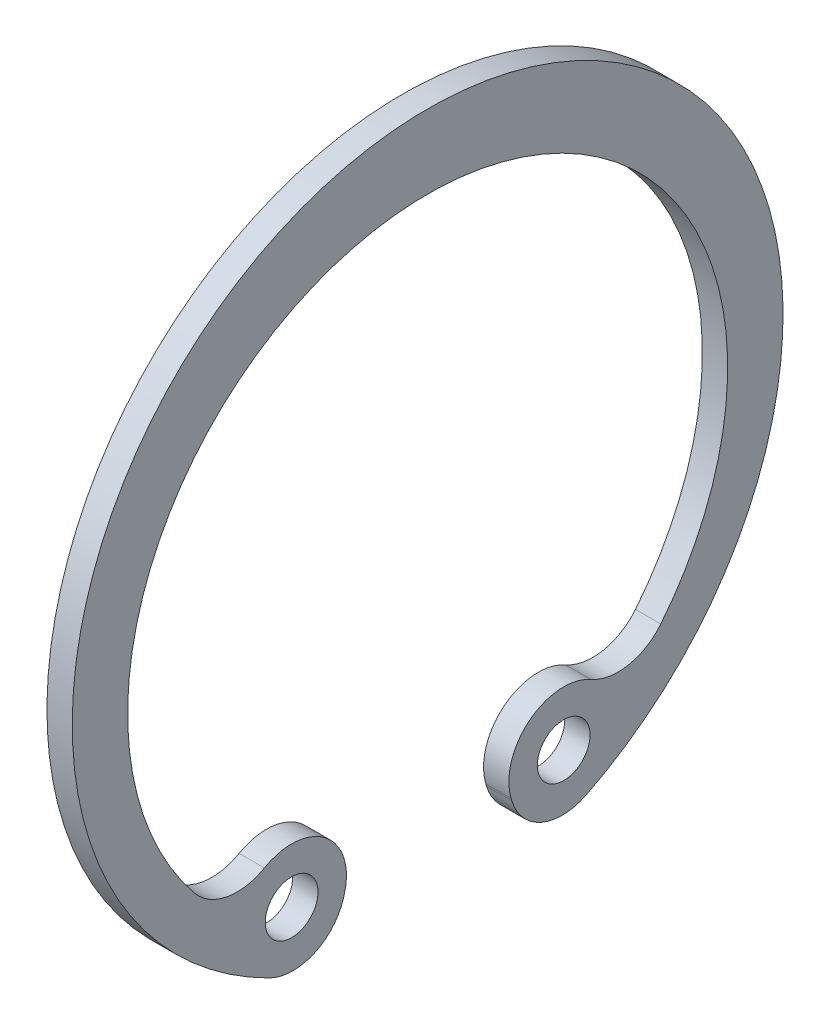
from build123d import *

# Parameters (mm, degrees)
BOSS_EXTRUDE1_DEPTH      = 0.6
BOSS_EXTRUDE1_DEPTH_BACK = 0.6
SKETCH1_R                = 1.25


with BuildPart() as part:
    # Sketch1 → Boss-Extrude1 (new, two sides: drawn at the far end of the back side and taken through both)
    with BuildSketch(Plane(origin=(0, 0, 0), x_dir=(0, 0, -1), z_dir=(1, 0, 0)).offset(-BOSS_EXTRUDE1_DEPTH_BACK)):
        with BuildLine():
            Line((-3.989591726, -13.555650403), (-3.955781017, -13.440769939))
            ThreePointArc((-3.955781017, -13.440769939), (-4.838154074, -10.666604704), (-7.741194161, -10.449963955))
            ThreePointArc((-7.741194161, -10.449963955), (-9.510855368, -10.748832352), (-11.052535247, -9.830003608))
            ThreePointArc((-11.052535247, -9.830003608), (-1.19e-07, 13.35), (11.052535397, -9.830003423))
            ThreePointArc((11.052535397, -9.830003423), (9.510855453, -10.748832336), (7.741194103, -10.449963921))
            ThreePointArc((7.741194103, -10.449963921), (4.838154048, -10.666604724), (3.955781017, -13.440769939))
            Line((3.955781017, -13.440769939), (3.989591726, -13.555650403))
            ThreePointArc((3.989591726, -13.555650403), (5.387658916, -15.140997106), (7.500750152, -15.088447473))
            ThreePointArc((7.500750152, -15.088447473), (0, 16.85), (-7.500750152, -15.088447473))
            ThreePointArc((-7.500750152, -15.088447473), (-5.387658916, -15.140997106), (-3.989591726, -13.555650403))
        make_face()
        with Locations((6.45, -12.706691151)):
            Circle(SKETCH1_R, mode=Mode.SUBTRACT)
        with Locations((-6.45, -12.706691151)):
            Circle(SKETCH1_R, mode=Mode.SUBTRACT)
    extrude(amount=BOSS_EXTRUDE1_DEPTH + BOSS_EXTRUDE1_DEPTH_BACK)


solid = part.part
